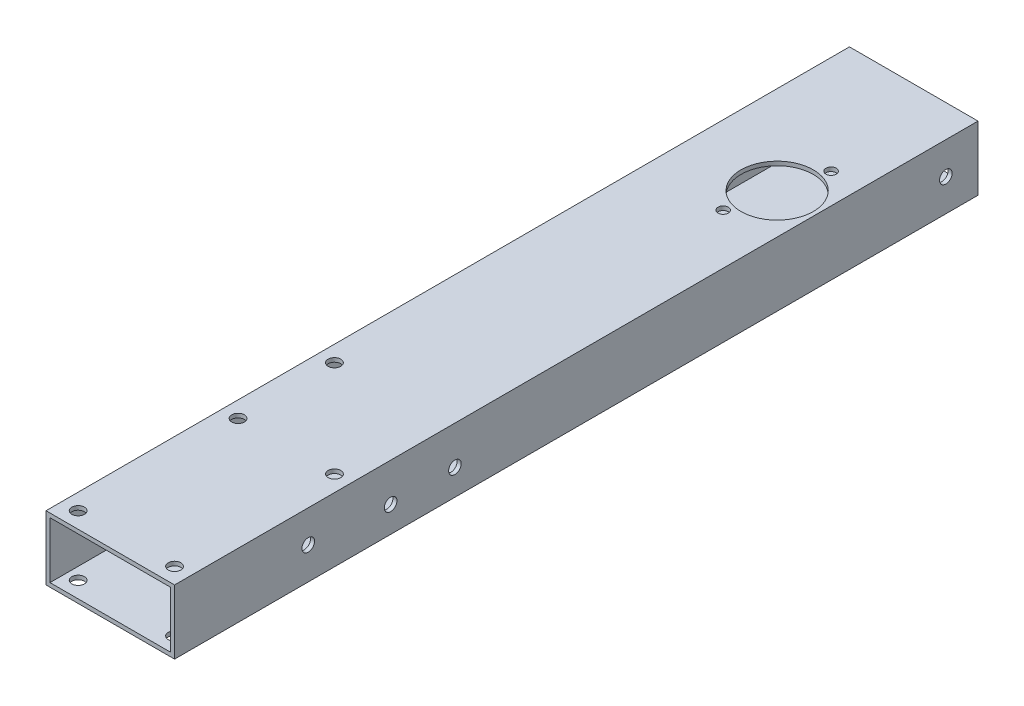
from build123d import *

# Parameters (mm, degrees)
BOSS_EXTRUDE1_DEPTH         = 158.750001
BOSS_EXTRUDE1_DEPTH_BACK    = 158.750001
SKETCH3_W                   = 50.8
SKETCH3_H                   = 25.4
SKETCH3_W_2                 = 47.625
SKETCH3_H_2                 = 22.225
SKETCH4_R                   = 14.2875
CUT_EXTRUDE1_DEPTH          = 39.37
F_10_CLEARANCE_HOLE1_D      = 4.9784
F_10_CLEARANCE_HOLE2_D      = 4.9784
F_20_0_161_DIAMETER_HOLE1_D = 4.0894
F_10_CLEARANCE_HOLE3_D      = 4.9784
F_10_CLEARANCE_HOLE3_DEPTH  = 12.7
F_10_CLEARANCE_HOLE3_TIP    = 1.495662253


with BuildPart() as part:
    # Sketch3 → Boss-Extrude1 (new, two sides: drawn at the far end of the back side and taken through both)
    with BuildSketch(Plane.XY.offset(-BOSS_EXTRUDE1_DEPTH_BACK)):
        Rectangle(SKETCH3_W, SKETCH3_H)
        Rectangle(SKETCH3_W_2, SKETCH3_H_2, mode=Mode.SUBTRACT)
    extrude(amount=BOSS_EXTRUDE1_DEPTH + BOSS_EXTRUDE1_DEPTH_BACK)

    # Sketch4 → Cut-Extrude1 (cut)
    with BuildSketch(Plane(origin=(0, 12.7, 0), x_dir=(1, 0, 0), z_dir=(0, 1, 0))):
        with Locations(Location((9.525, 95.250000508, 0), (0, 0, 180))):
            Circle(SKETCH4_R)
    extrude(amount=-CUT_EXTRUDE1_DEPTH, mode=Mode.SUBTRACT)

    # #10 Clearance Hole1 (through all)
    with Locations(Plane.ZY.offset(25.4)):
        with Locations((73.358188649, -2.425), (47.958188649, -2.425)):
            Hole(F_10_CLEARANCE_HOLE1_D / 2)

    # #10 Clearance Hole2 (through all)
    with Locations(Plane(origin=(0, -12.7, 0), x_dir=(-1, 0, 0), z_dir=(0, -1, 0))):
        with Locations((19.05, -51.113080493), (19.05, -89.213080493), (-19.05, -89.213080493), (-19.05, -152.400000508), (19.05, -152.400000508)):
            Hole(F_10_CLEARANCE_HOLE2_D / 2)

    # #20 (0.161) Diameter Hole1 (through all)
    with Locations(Plane(origin=(0, 12.7, 0), x_dir=(1, 0, 0), z_dir=(0, 1, 0))):
        with Locations((13.524629742, 112.574300261), (5.525370258, 77.925700755)):
            Hole(F_20_0_161_DIAMETER_HOLE1_D / 2)

    # #10 Clearance Hole3
    with Locations(Plane(origin=(25.4, 0, 0), x_dir=(0, 0, -1), z_dir=(1, 0, 0))):
        with Locations((-105.917999492, 0), (146.050000508, 0)):
            Hole(F_10_CLEARANCE_HOLE3_D / 2, depth=F_10_CLEARANCE_HOLE3_DEPTH)
            with Locations((0, 0, -(F_10_CLEARANCE_HOLE3_DEPTH + F_10_CLEARANCE_HOLE3_TIP / 2))):  # 118° drill point
                Cone(0, F_10_CLEARANCE_HOLE3_D / 2, F_10_CLEARANCE_HOLE3_TIP, mode=Mode.SUBTRACT)


solid = part.part
